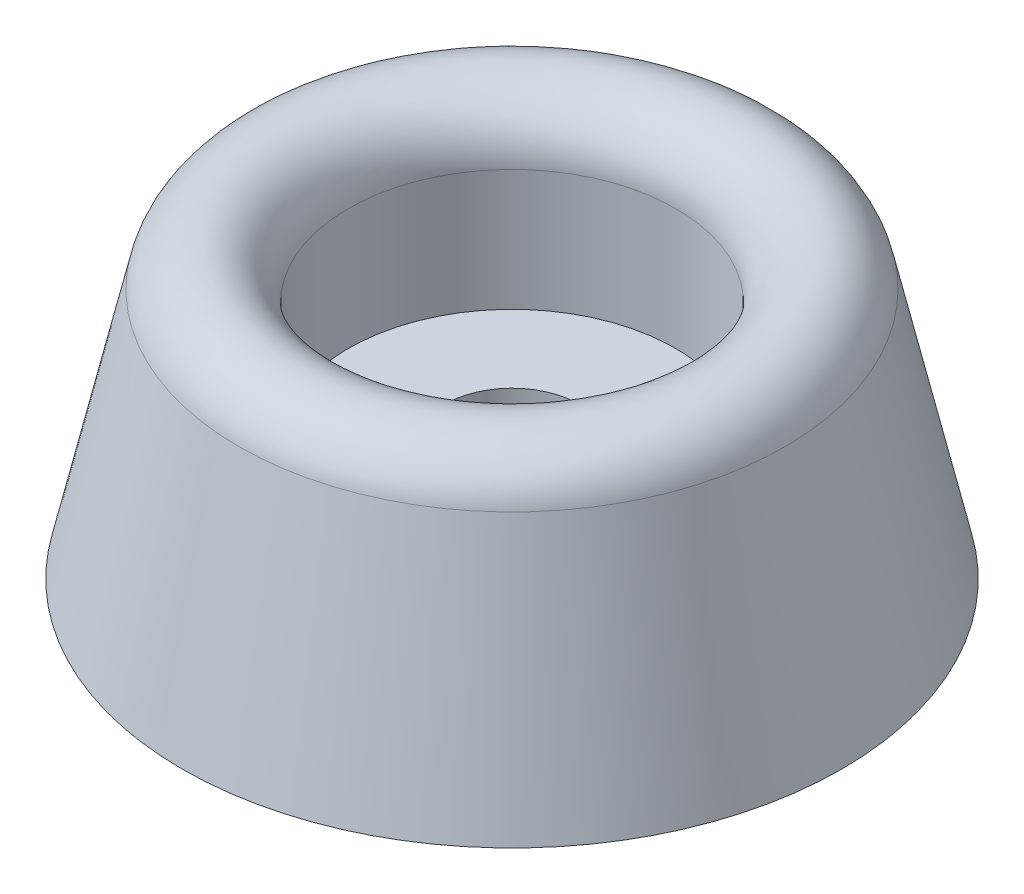
from build123d import *


with BuildPart() as part:
    # Croquis1 → Revolución1 (revolve)
    with BuildSketch(Plane(origin=(0, 0, 0), x_dir=(-1, 0, 0), z_dir=(0, 0, -1)), mode=Mode.PRIVATE) as revoluci_n1_sk:
        with BuildLine():
            Line((-1.6, -3e-09), (-1.6, 2.8))
            Line((-1.6, 2.8), (-3.9, 2.8))
            Line((-3.9, 2.8), (-3.9, 5.683813699))
            ThreePointArc((-3.9, 5.683813699), (-5.07022676, 6.991881813), (-6.500000001, 5.973932235))
            Line((-6.500000001, 5.973932235), (-7.849999989, -3e-09))
            Line((-7.849999989, -3e-09), (-1.6, -3e-09))
        make_face()
    revolve(revoluci_n1_sk.sketch.rotate(Axis((0, -3e-09, 0), (0, 1, 0)), 270), axis=Axis((0, -3e-09, 0), (0, 1, 0)))


solid = part.part
